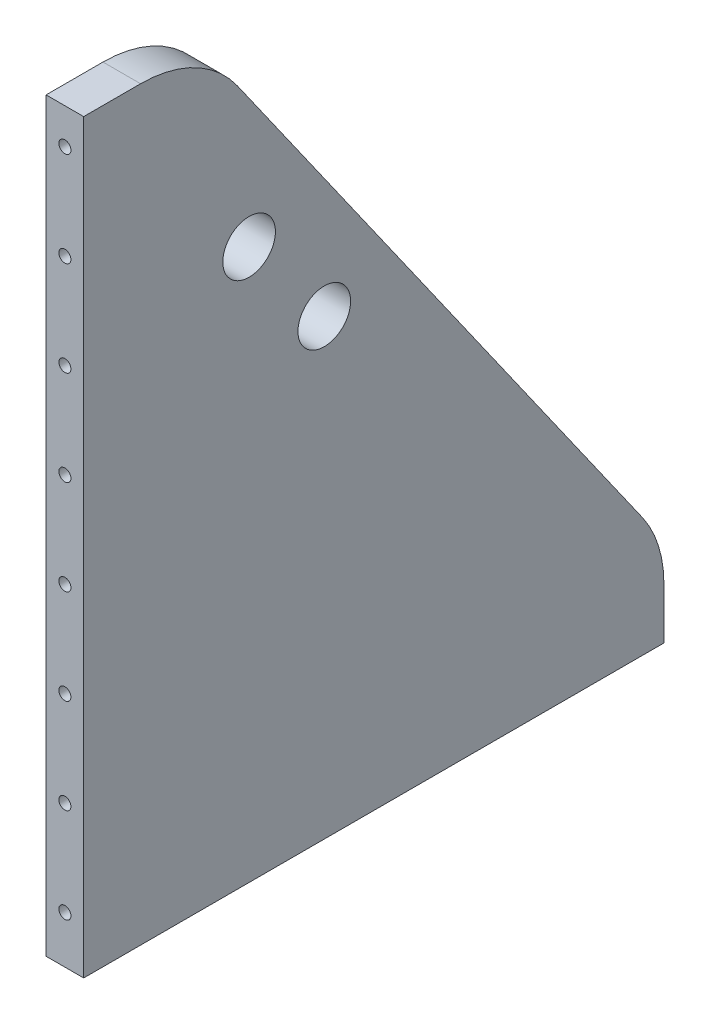
from build123d import *

# Parameters (mm, degrees)
BOSS_EXTRUDE1_DEPTH = 31.75
CUT_EXTRUDE1_DEPTH  = 813.777990905
LPATTERN1_COUNT     = 8
LPATTERN1_PITCH     = 80
LPATTERN2_COUNT     = 6
LPATTERN2_PITCH     = 80
SKETCH8_R           = 22.225
CUT_EXTRUDE2_DEPTH  = 813.777990905


with BuildPart() as part:
    # Sketch1 → Boss-Extrude1 (new body)
    with BuildSketch(Plane(origin=(0, 0, 0), x_dir=(0, 0, -1), z_dir=(1, 0, 0))):
        with BuildLine():
            Line((0, 0), (0, 640))
            Line((0, 640), (58.049523734, 640))
            ThreePointArc((58.049523734, 640), (104.150200697, 628.73966184), (139.86869342, 597.494551671))
            Line((139.86869342, 597.494551671), (481.819169686, 110.872720062))
            ThreePointArc((481.819169686, 110.872720062), (495.346517945, 83.528483741), (500, 53.378168391))
            Line((500, 53.378168391), (500, 0))
            Line((500, 0), (0, 0))
        make_face()
    extrude(amount=BOSS_EXTRUDE1_DEPTH)

    # Sketch2 → Cut-Extrude1 (cut, through all)
    with BuildSketch(Plane.ZY):
        Polygon((0, 640), (-10, 640), (-10, 10), (-500, 10), (-500, 0), (0, 0), align=None)
    extrude(amount=-CUT_EXTRUDE1_DEPTH, mode=Mode.SUBTRACT)

    # Sketch4 → M12 Tapped Hole1 (revolve, cut)
    with BuildSketch(Plane(origin=(15.875, 50, -10), x_dir=(0, -1, 0), z_dir=(1, 0, 0))):
        Polygon((0, 0), (0, 47.054389157), (5.1, 43.99), (5.1, 0), align=None)
    m12_tapped_hole1 = revolve(axis=Axis((15.875, 50, -3.65), (0, 0, -1)), mode=Mode.SUBTRACT)

    # LPattern1: M12 Tapped Hole1 ×8
    with Locations(*[(0, i * LPATTERN1_PITCH, 0) for i in range(1, LPATTERN1_COUNT)]):
        add(m12_tapped_hole1, mode=Mode.SUBTRACT)

    # Sketch6 → M12 Tapped Hole2 (revolve, cut)
    with BuildSketch(Plane(origin=(15.875, 10, -70), x_dir=(0, 0, -1), z_dir=(1, 0, 0))):
        Polygon((0, 0), (0, 47.054389157), (5.1, 43.99), (5.1, 0), align=None)
    m12_tapped_hole2 = revolve(axis=Axis((15.875, 3.65, -70), (0, 1, 0)), mode=Mode.SUBTRACT)

    # LPattern2: M12 Tapped Hole2 ×6
    with Locations(*[(0, 0, -i * LPATTERN2_PITCH) for i in range(1, LPATTERN2_COUNT)]):
        add(m12_tapped_hole2, mode=Mode.SUBTRACT)

    # Sketch8 → Cut-Extrude2 (cut, through all)
    with BuildSketch(Plane.ZY):
        with Locations((-213.2, 392.35)):
            Circle(SKETCH8_R)
        with Locations((-149.7, 474.9)):
            Circle(SKETCH8_R)
    extrude(amount=-CUT_EXTRUDE2_DEPTH, mode=Mode.SUBTRACT)


solid = part.part
